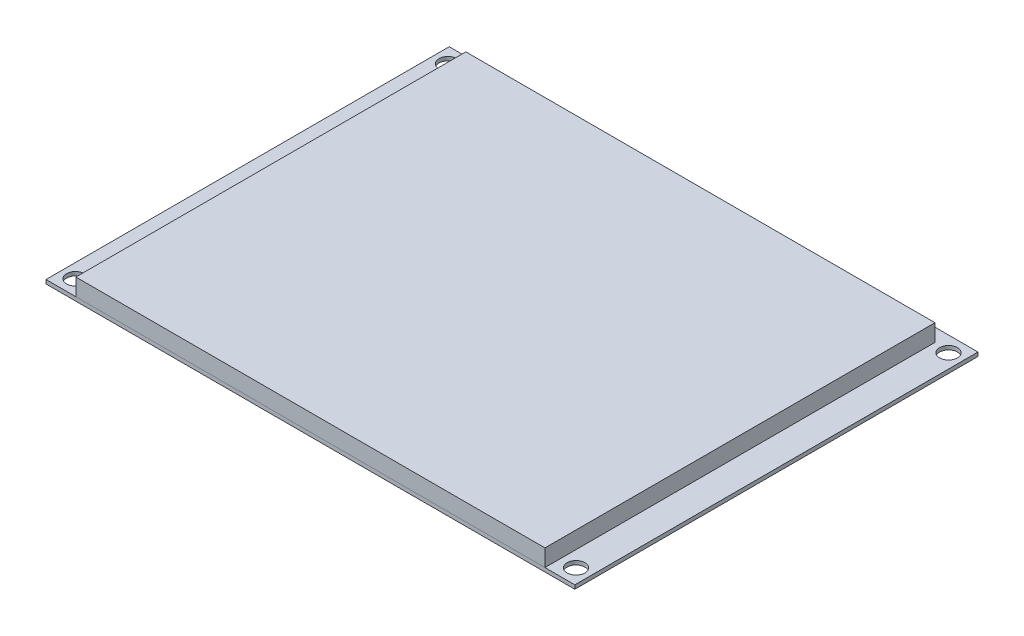
from build123d import *

# Parameters (mm, degrees)
SKETCH1_W           = 86.614
SKETCH1_H           = 66.04
BOSS_EXTRUDE1_DEPTH = 0.635
SKETCH2_W           = 47.498
SKETCH2_H           = 4.826
CUT_EXTRUDE1_DEPTH  = 0.635
SKETCH3_W           = 76.835
SKETCH3_H           = 63.881
BOSS_EXTRUDE2_DEPTH = 2.794
SKETCH4_W           = 27.686
SKETCH4_H           = 4.445
BOSS_EXTRUDE3_DEPTH = 2.159
SKETCH6_R           = 1.4605
CUT_EXTRUDE2_DEPTH  = 55.745249958


with BuildPart() as part:
    # Sketch1 → Boss-Extrude1 (new body)
    with BuildSketch(Plane(origin=(0, 0, 0), x_dir=(1, 0, 0), z_dir=(0, 1, 0))):
        Rectangle(SKETCH1_W, SKETCH1_H)
    extrude(amount=BOSS_EXTRUDE1_DEPTH)

    # Sketch2 → Cut-Extrude1 (cut)
    with BuildSketch(Plane.XZ):
        with Locations((0, -30.607)):
            Rectangle(SKETCH2_W, SKETCH2_H)
    extrude(amount=-CUT_EXTRUDE1_DEPTH, mode=Mode.SUBTRACT)

    # Sketch6 → Cut-Extrude2 (cut, through all)
    with BuildSketch(Plane(origin=(0, 3.429, 0), x_dir=(1, 0, 0), z_dir=(0, 1, 0))):
        with Locations(Location((-40.9956, 30.5054, 0), (0, 0, 270))):
            Circle(SKETCH6_R)
        with Locations(Location((-40.9956, -30.5054, 0), (0, 0, 270))):
            Circle(SKETCH6_R)
        with Locations(Location((40.9956, -30.5054, 0), (0, 0, 270))):
            Circle(SKETCH6_R)
        with Locations(Location((40.9956, 30.5054, 0), (0, 0, 270))):
            Circle(SKETCH6_R)
    extrude(amount=-CUT_EXTRUDE2_DEPTH, mode=Mode.SUBTRACT)


with BuildPart() as body_2:
    # Sketch3 → Boss-Extrude2 (new body)
    with BuildSketch(Plane(origin=(0, 0.635, 0), x_dir=(1, 0, 0), z_dir=(0, 1, 0))):
        with Locations((0, -1.0795)):
            Rectangle(SKETCH3_W, SKETCH3_H)
    extrude(amount=BOSS_EXTRUDE2_DEPTH)


with BuildPart() as body_3:
    # Sketch4 → Boss-Extrude3 (new body)
    with BuildSketch(Plane.XZ):
        with Locations((0, -9.7155)):
            Rectangle(SKETCH4_W, SKETCH4_H)
    extrude(amount=BOSS_EXTRUDE3_DEPTH)


solid = Compound([part.part, body_2.part, body_3.part])
